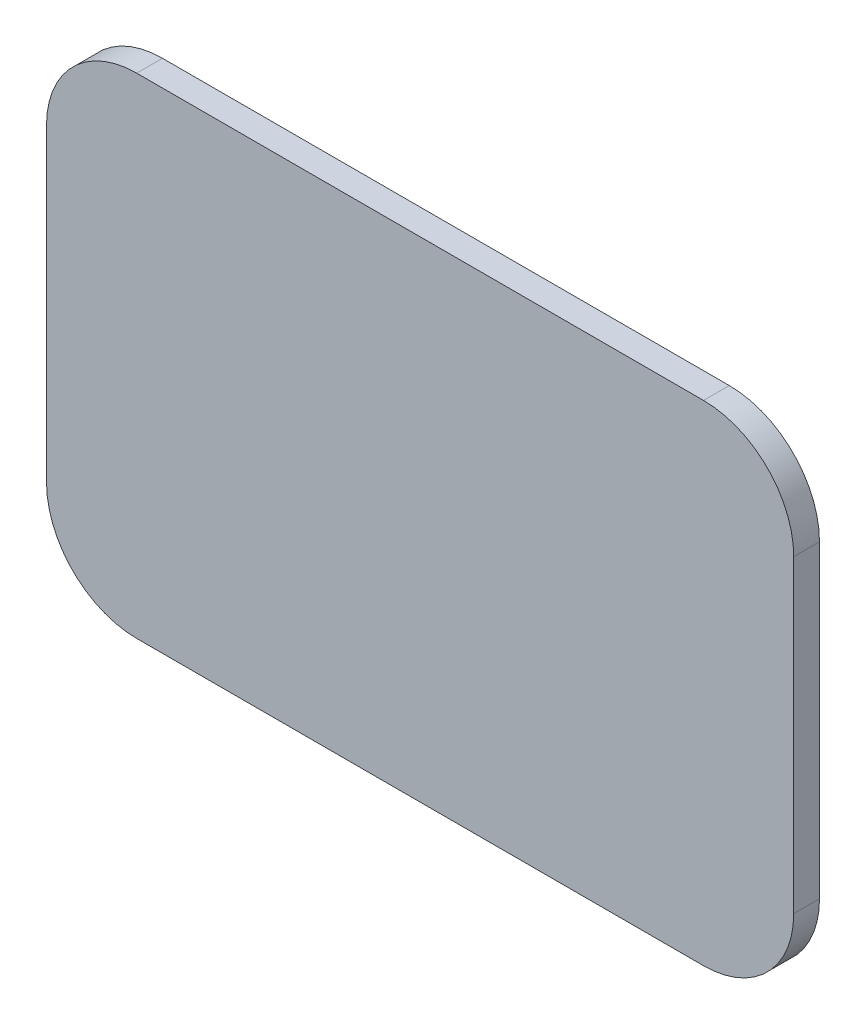
from build123d import *

# Parameters (mm, degrees)
BOSS_EXTRUDE1_DEPTH = 1


with BuildPart() as part:
    # Sketch1 → Boss-Extrude1 (new body)
    with BuildSketch(Plane.XY):
        with BuildLine():
            Line((-14.5, -6), (-14.5, 6))
            ThreePointArc((-14.5, 6), (-13.474873734, 8.474873734), (-11, 9.5))
            Line((-11, 9.5), (11, 9.5))
            ThreePointArc((11, 9.5), (13.474873734, 8.474873734), (14.5, 6))
            Line((14.5, 6), (14.5, -6))
            ThreePointArc((14.5, -6), (13.474873734, -8.474873734), (11, -9.5))
            Line((11, -9.5), (-11, -9.5))
            ThreePointArc((-11, -9.5), (-13.474873734, -8.474873734), (-14.5, -6))
        make_face()
    extrude(amount=BOSS_EXTRUDE1_DEPTH)


solid = part.part
